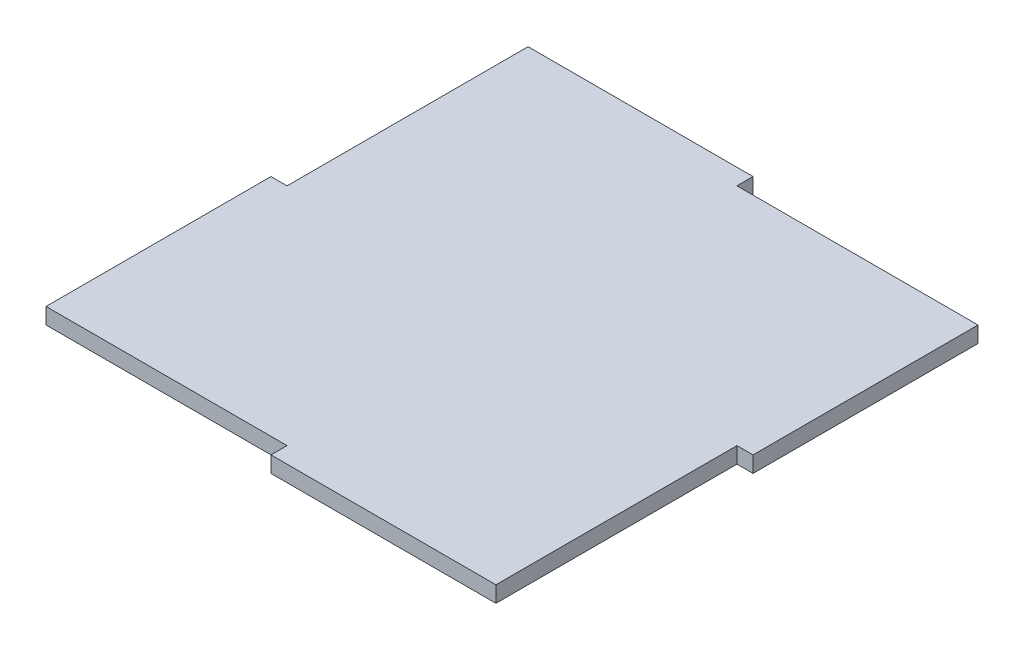
from build123d import *

# Parameters (mm, degrees)
SKETCH1_W           = 6.35
SKETCH1_H           = 88.9
SKETCH1_W_2         = 88.9
SKETCH1_H_2         = 6.35
SKETCH1_W_3         = 177.8
SKETCH1_H_3         = 177.8
BOSS_EXTRUDE1_DEPTH = 6.35


with BuildPart() as part:
    # Sketch1 → Boss-Extrude1 (new body)
    with BuildSketch(Plane(origin=(0, 0, 0), x_dir=(1, 0, 0), z_dir=(0, 1, 0))):
        with Locations((-115.681214689, -40.037288136)):
            Rectangle(SKETCH1_W, SKETCH1_H)
        with Locations((-68.056214689, 96.487711864)):
            Rectangle(SKETCH1_W_2, SKETCH1_H_2)
        with Locations((-23.606214689, 4.412711864)):
            Rectangle(SKETCH1_W_3, SKETCH1_H_3)
        with Locations((68.468785311, 48.862711864)):
            Rectangle(SKETCH1_W, SKETCH1_H)
        with Locations((20.843785311, -87.662288136)):
            Rectangle(SKETCH1_W_2, SKETCH1_H_2)
    extrude(amount=BOSS_EXTRUDE1_DEPTH)


solid = part.part
